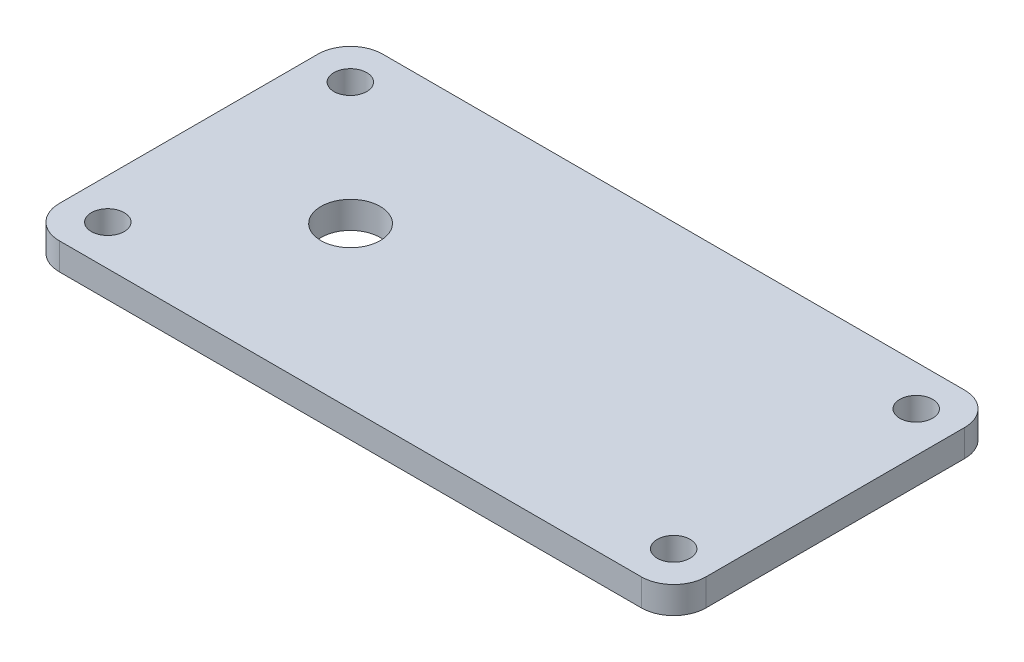
from build123d import *

# Parameters (mm, degrees)
SKETCH1_W               = 120
SKETCH1_H               = 60
BOSS_EXTRUDE1_DEPTH     = 5
SKETCH2_R               = 3.05
CUT_EXTRUDE1_DEPTH      = 68.268120235
MIRROR2_COPY_1_SKETCH_R = 3.05
MIRROR2_COPY_1_DEPTH    = 68.268120235
SKETCH3_R               = 5.5
CUT_EXTRUDE2_DEPTH      = 68.268120235
FILLET1_R               = 6


with BuildPart() as part:
    # Sketch1 → Boss-Extrude1 (new body)
    with BuildSketch(Plane(origin=(0, 0, 0), x_dir=(1, 0, 0), z_dir=(0, 1, 0))):
        Rectangle(SKETCH1_W, SKETCH1_H)
    extrude(amount=BOSS_EXTRUDE1_DEPTH)

    # Sketch2 → Cut-Extrude1 (cut, through all)
    with BuildSketch(Plane(origin=(0, 5, 0), x_dir=(1, 0, 0), z_dir=(0, 1, 0))):
        with Locations(Location((-52.5, 22.5, 0), (0, 0, 270))):
            Circle(SKETCH2_R)
    cut_extrude1 = extrude(amount=-CUT_EXTRUDE1_DEPTH, mode=Mode.SUBTRACT)

    # Mirror1: Cut-Extrude1 across plane
    add(cut_extrude1.mirror(Plane.XY), mode=Mode.SUBTRACT)

    # Mirror2: Cut-Extrude1 across plane
    add(cut_extrude1.mirror(Plane(origin=(0, 0, 0), x_dir=(0, 0, 1), z_dir=(1, 0, 0))), mode=Mode.SUBTRACT)

    # Mirror2 copy 1 sketch → Mirror2 copy 1 (cut, through all)
    with BuildSketch(Plane(origin=(0, 5, 0), x_dir=(-1, 0, 0), z_dir=(0, 1, 0))):
        with Locations(Location((-52.5, 22.5, 0), (0, 0, 270))):
            Circle(MIRROR2_COPY_1_SKETCH_R)
    extrude(amount=-MIRROR2_COPY_1_DEPTH, mode=Mode.SUBTRACT)

    # Sketch3 → Cut-Extrude2 (cut, through all)
    with BuildSketch(Plane(origin=(0, 5, 0), x_dir=(1, 0, 0), z_dir=(0, 1, 0))):
        with Locations(Location((-29.74982269, -0.203269064, 0), (0, 0, 270))):
            Circle(SKETCH3_R)
    extrude(amount=-CUT_EXTRUDE2_DEPTH, mode=Mode.SUBTRACT)

    # Fillet1
    fillet1_edges = [part.edges().sort_by_distance(p)[0] for p in [
        (60, 2.5, 30),
        (-60, 2.5, 30),
        (-60, 2.5, -30),
        (60, 2.5, -30),
    ]]
    fillet(fillet1_edges, radius=FILLET1_R)


solid = part.part
